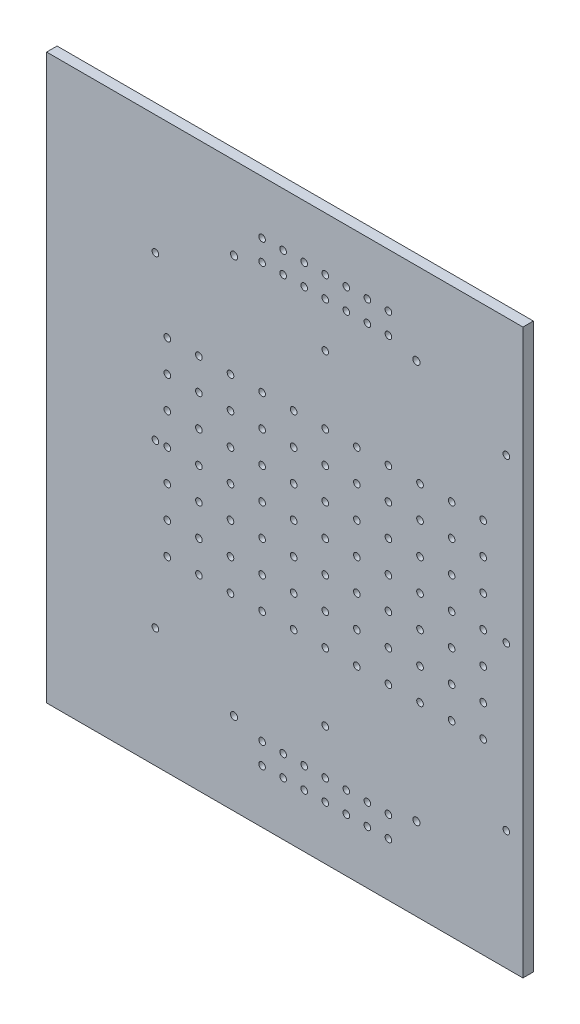
from build123d import *

# Parameters (mm, degrees)
SKETCH1_W                          = 287.27
SKETCH1_H                          = 340
BASE_PLATE_EXTRUDE_DEPTH           = 6.3
SKETCH3_R                          = 2
SKETCH3_R_2                        = 2.15
PLATE_TO_PLATE_MNT_THRU_HOLE_DEPTH = 223.644791596
SKETCH4_R                          = 2
CENTER_PERFORATION_THRU_HOLE_DEPTH = 223.644791596
SKETCH5_R                          = 2
SIDE_PERFORATION_THRU_HOLE_DEPTH   = 223.644791596


with BuildPart() as part:
    # Sketch1 → Base_Plate-Extrude (new body)
    with BuildSketch(Plane.XY):
        Rectangle(SKETCH1_W, SKETCH1_H)
    extrude(amount=BASE_PLATE_EXTRUDE_DEPTH)

    # Sketch3 → Plate_to_Plate_Mnt-Thru-Hole (cut, through all)
    with BuildSketch(Plane.XY.offset(6.3)):
        with Locations((133.635, 98)):
            Circle(SKETCH3_R)
        with Locations((24.415, 98)):
            Circle(SKETCH3_R)
        with Locations((-78.025, 98)):
            Circle(SKETCH3_R)
        with Locations((-78.025, -98)):
            Circle(SKETCH3_R)
        with Locations((24.415, -98)):
            Circle(SKETCH3_R)
        with Locations((133.635, -98)):
            Circle(SKETCH3_R)
        with Locations((133.635, 0)):
            Circle(SKETCH3_R)
        with Locations((-78.025, 0)):
            Circle(SKETCH3_R)
        with Locations((79.415, -120.25)):
            Circle(SKETCH3_R_2)
        with Locations((-30.585, -120.25)):
            Circle(SKETCH3_R_2)
        with Locations((-30.585, 120.25)):
            Circle(SKETCH3_R_2)
        with Locations((79.415, 120.25)):
            Circle(SKETCH3_R_2)
    extrude(amount=-PLATE_TO_PLATE_MNT_THRU_HOLE_DEPTH, mode=Mode.SUBTRACT)

    # Sketch4 → Center_Perforation-Thru-Hole (cut, through all)
    with BuildSketch(Plane.XY.offset(6.3)):
        with Locations((-70.835, 0)):
            Circle(SKETCH4_R)
        with Locations((-51.785, 0)):
            Circle(SKETCH4_R)
        with Locations((-32.735, 0)):
            Circle(SKETCH4_R)
        with Locations((-13.685, 0)):
            Circle(SKETCH4_R)
        with Locations((5.365, 0)):
            Circle(SKETCH4_R)
        with Locations((24.415, 0)):
            Circle(SKETCH4_R)
        with Locations((43.465, 0)):
            Circle(SKETCH4_R)
        with Locations((62.515, 0)):
            Circle(SKETCH4_R)
        with Locations((81.565, 0)):
            Circle(SKETCH4_R)
        with Locations((100.615, 0)):
            Circle(SKETCH4_R)
        with Locations((119.665, 0)):
            Circle(SKETCH4_R)
        with Locations((-70.835, 19.05)):
            Circle(SKETCH4_R)
        with Locations((-51.785, 19.05)):
            Circle(SKETCH4_R)
        with Locations((-32.735, 19.05)):
            Circle(SKETCH4_R)
        with Locations((-13.685, 19.05)):
            Circle(SKETCH4_R)
        with Locations((5.365, 19.05)):
            Circle(SKETCH4_R)
        with Locations((24.415, 19.05)):
            Circle(SKETCH4_R)
        with Locations((43.465, 19.05)):
            Circle(SKETCH4_R)
        with Locations((62.515, 19.05)):
            Circle(SKETCH4_R)
        with Locations((81.565, 19.05)):
            Circle(SKETCH4_R)
        with Locations((100.615, 19.05)):
            Circle(SKETCH4_R)
        with Locations((119.665, 19.05)):
            Circle(SKETCH4_R)
        with Locations((-70.835, 38.1)):
            Circle(SKETCH4_R)
        with Locations((-51.785, 38.1)):
            Circle(SKETCH4_R)
        with Locations((-32.735, 38.1)):
            Circle(SKETCH4_R)
        with Locations((-13.685, 38.1)):
            Circle(SKETCH4_R)
        with Locations((5.365, 38.1)):
            Circle(SKETCH4_R)
        with Locations((24.415, 38.1)):
            Circle(SKETCH4_R)
        with Locations((43.465, 38.1)):
            Circle(SKETCH4_R)
        with Locations((62.515, 38.1)):
            Circle(SKETCH4_R)
        with Locations((81.565, 38.1)):
            Circle(SKETCH4_R)
        with Locations((100.615, 38.1)):
            Circle(SKETCH4_R)
        with Locations((119.665, 38.1)):
            Circle(SKETCH4_R)
        with Locations((-70.835, 57.15)):
            Circle(SKETCH4_R)
        with Locations((-51.785, 57.15)):
            Circle(SKETCH4_R)
        with Locations((-32.735, 57.15)):
            Circle(SKETCH4_R)
        with Locations((-13.685, 57.15)):
            Circle(SKETCH4_R)
        with Locations((5.365, 57.15)):
            Circle(SKETCH4_R)
        with Locations((24.415, 57.15)):
            Circle(SKETCH4_R)
        with Locations((43.465, 57.15)):
            Circle(SKETCH4_R)
        with Locations((62.515, 57.15)):
            Circle(SKETCH4_R)
        with Locations((81.565, 57.15)):
            Circle(SKETCH4_R)
        with Locations((100.615, 57.15)):
            Circle(SKETCH4_R)
        with Locations((119.665, 57.15)):
            Circle(SKETCH4_R)
        with Locations((-70.835, -19.05)):
            Circle(SKETCH4_R)
        with Locations((-51.785, -19.05)):
            Circle(SKETCH4_R)
        with Locations((-32.735, -19.05)):
            Circle(SKETCH4_R)
        with Locations((-13.685, -19.05)):
            Circle(SKETCH4_R)
        with Locations((5.365, -19.05)):
            Circle(SKETCH4_R)
        with Locations((24.415, -19.05)):
            Circle(SKETCH4_R)
        with Locations((43.465, -19.05)):
            Circle(SKETCH4_R)
        with Locations((62.515, -19.05)):
            Circle(SKETCH4_R)
        with Locations((81.565, -19.05)):
            Circle(SKETCH4_R)
        with Locations((100.615, -19.05)):
            Circle(SKETCH4_R)
        with Locations((119.665, -19.05)):
            Circle(SKETCH4_R)
        with Locations((-70.835, -38.1)):
            Circle(SKETCH4_R)
        with Locations((-51.785, -38.1)):
            Circle(SKETCH4_R)
        with Locations((-32.735, -38.1)):
            Circle(SKETCH4_R)
        with Locations((-13.685, -38.1)):
            Circle(SKETCH4_R)
        with Locations((5.365, -38.1)):
            Circle(SKETCH4_R)
        with Locations((24.415, -38.1)):
            Circle(SKETCH4_R)
        with Locations((43.465, -38.1)):
            Circle(SKETCH4_R)
        with Locations((62.515, -38.1)):
            Circle(SKETCH4_R)
        with Locations((81.565, -38.1)):
            Circle(SKETCH4_R)
        with Locations((100.615, -38.1)):
            Circle(SKETCH4_R)
        with Locations((119.665, -38.1)):
            Circle(SKETCH4_R)
        with Locations((-70.835, -57.15)):
            Circle(SKETCH4_R)
        with Locations((-51.785, -57.15)):
            Circle(SKETCH4_R)
        with Locations((-32.735, -57.15)):
            Circle(SKETCH4_R)
        with Locations((-13.685, -57.15)):
            Circle(SKETCH4_R)
        with Locations((5.365, -57.15)):
            Circle(SKETCH4_R)
        with Locations((24.415, -57.15)):
            Circle(SKETCH4_R)
        with Locations((43.465, -57.15)):
            Circle(SKETCH4_R)
        with Locations((62.515, -57.15)):
            Circle(SKETCH4_R)
        with Locations((81.565, -57.15)):
            Circle(SKETCH4_R)
        with Locations((100.615, -57.15)):
            Circle(SKETCH4_R)
        with Locations((119.665, -57.15)):
            Circle(SKETCH4_R)
    extrude(amount=-CENTER_PERFORATION_THRU_HOLE_DEPTH, mode=Mode.SUBTRACT)

    # Sketch5 → Side-Perforation-Thru-Hole (cut, through all)
    with BuildSketch(Plane.XY.offset(6.3)):
        with Locations((24.415, -125.08)):
            Circle(SKETCH5_R)
        with Locations((37.115, -125.08)):
            Circle(SKETCH5_R)
        with Locations((49.815, -125.08)):
            Circle(SKETCH5_R)
        with Locations((62.515, -125.08)):
            Circle(SKETCH5_R)
        with Locations((11.715, -125.08)):
            Circle(SKETCH5_R)
        with Locations((-0.985, -125.08)):
            Circle(SKETCH5_R)
        with Locations((-13.685, -125.08)):
            Circle(SKETCH5_R)
        with Locations((24.415, -137.78)):
            Circle(SKETCH5_R)
        with Locations((37.115, -137.78)):
            Circle(SKETCH5_R)
        with Locations((49.815, -137.78)):
            Circle(SKETCH5_R)
        with Locations((62.515, -137.78)):
            Circle(SKETCH5_R)
        with Locations((11.715, -137.78)):
            Circle(SKETCH5_R)
        with Locations((-0.985, -137.78)):
            Circle(SKETCH5_R)
        with Locations((-13.685, -137.78)):
            Circle(SKETCH5_R)
        with Locations(Location((-13.685, 137.78, 0), (0, 0, 180))):
            Circle(SKETCH5_R)
        with Locations(Location((-0.985, 137.78, 0), (0, 0, 180))):
            Circle(SKETCH5_R)
        with Locations(Location((11.715, 137.78, 0), (0, 0, 180))):
            Circle(SKETCH5_R)
        with Locations(Location((62.515, 137.78, 0), (0, 0, 180))):
            Circle(SKETCH5_R)
        with Locations(Location((49.815, 137.78, 0), (0, 0, 180))):
            Circle(SKETCH5_R)
        with Locations(Location((37.115, 137.78, 0), (0, 0, 180))):
            Circle(SKETCH5_R)
        with Locations(Location((24.415, 137.78, 0), (0, 0, 180))):
            Circle(SKETCH5_R)
        with Locations(Location((-13.685, 125.08, 0), (0, 0, 180))):
            Circle(SKETCH5_R)
        with Locations(Location((-0.985, 125.08, 0), (0, 0, 180))):
            Circle(SKETCH5_R)
        with Locations(Location((11.715, 125.08, 0), (0, 0, 180))):
            Circle(SKETCH5_R)
        with Locations(Location((62.515, 125.08, 0), (0, 0, 180))):
            Circle(SKETCH5_R)
        with Locations(Location((49.815, 125.08, 0), (0, 0, 180))):
            Circle(SKETCH5_R)
        with Locations(Location((37.115, 125.08, 0), (0, 0, 180))):
            Circle(SKETCH5_R)
        with Locations(Location((24.415, 125.08, 0), (0, 0, 180))):
            Circle(SKETCH5_R)
    extrude(amount=-SIDE_PERFORATION_THRU_HOLE_DEPTH, mode=Mode.SUBTRACT)


solid = part.part
